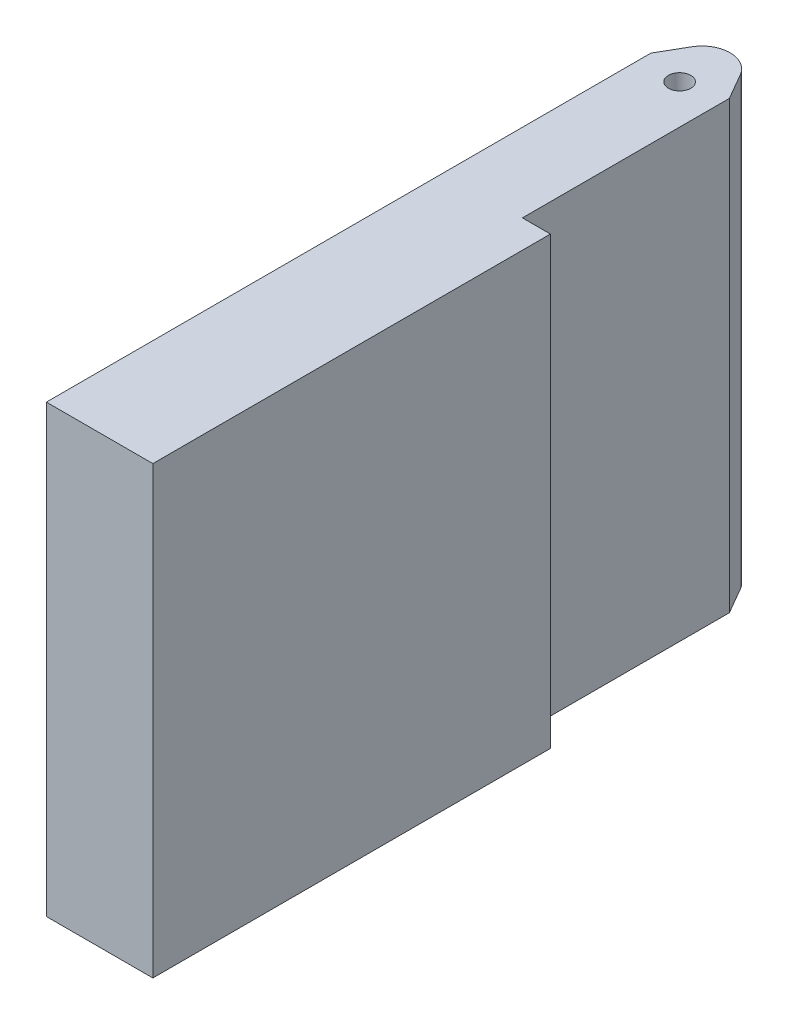
from build123d import *

# Parameters (mm, degrees)
SKETCH1_W           = 22
SKETCH1_H           = 120
BOSS_EXTRUDE1_DEPTH = 79.5
SKETCH2_OUTSIDE_W   = 53.124
SKETCH2_OUTSIDE_H   = 151.124
CUT_EXTRUDE1_DEPTH  = 101.206037742
FILLET1_R           = 5
CUT_EXTRUDE2_DEPTH  = 101.206037742
SKETCH4_W           = 96.947441117
SKETCH4_H           = 79.5
BOSS_EXTRUDE2_DEPTH = 5
SKETCH5_W           = 4
SKETCH5_H           = 96.947441117
CUT_EXTRUDE3_DEPTH  = 101.877400839
SKETCH6_W           = 4
SKETCH6_H           = 96.947441117
CUT_EXTRUDE4_DEPTH  = 101.877400839
SKETCH7_R           = 2
CUT_EXTRUDE5_DEPTH  = 101.320735643
SKETCH8_W           = 5
SKETCH8_H           = 26
CUT_EXTRUDE6_DEPTH  = 101.320735643


with BuildPart() as part:
    # Sketch1 → Boss-Extrude1 (new body)
    with BuildSketch(Plane(origin=(0, 0, 0), x_dir=(1, 0, 0), z_dir=(0, 1, 0))):
        Rectangle(SKETCH1_W, SKETCH1_H)
    extrude(amount=BOSS_EXTRUDE1_DEPTH)

    # Sketch2 outside → Cut-Extrude1 (cut, through all)
    with BuildSketch(Plane(origin=(0, 79.5, 0), x_dir=(1, 0, 0), z_dir=(0, 1, 0))):
        Rectangle(SKETCH2_OUTSIDE_W, SKETCH2_OUTSIDE_H)
        Polygon((0, 60), (-11, 40.947441117), (-11, -60), (11, -60), (11, 40.947441117), align=None, mode=Mode.SUBTRACT)
    extrude(amount=-CUT_EXTRUDE1_DEPTH, mode=Mode.SUBTRACT)

    # Fillet1
    fillet1_edges = [part.edges().sort_by_distance(p)[0] for p in [
        (0, 39.75, -60),
    ]]
    fillet(fillet1_edges, radius=FILLET1_R)

    # Sketch3 → Cut-Extrude2 (cut, through all)
    with BuildSketch(Plane(origin=(0, 79.5, 0), x_dir=(1, 0, 0), z_dir=(0, 1, 0))):
        Polygon((-11, 36.947441117), (-7, 36.947441117), (-7, 47.875644347), (-11, 40.947441117), align=None)
        Polygon((7, 47.875644347), (11, 40.947441117), (11, 36.947441117), (7, 36.947441117), align=None)
    extrude(amount=-CUT_EXTRUDE2_DEPTH, mode=Mode.SUBTRACT)

    # Sketch4 → Boss-Extrude2 (add)
    with BuildSketch(Plane(origin=(11, 0, 0), x_dir=(0, 0, -1), z_dir=(1, 0, 0))):
        with Locations((-11.526279442, 39.75)):
            Rectangle(SKETCH4_W, SKETCH4_H)
    extrude(amount=BOSS_EXTRUDE2_DEPTH)

    # Sketch5 → Cut-Extrude3 (cut, through all)
    with BuildSketch(Plane(origin=(0, 79.5, 0), x_dir=(1, 0, 0), z_dir=(0, 1, 0))):
        with Locations((-9, -11.526279442)):
            Rectangle(SKETCH5_W, SKETCH5_H)
    extrude(amount=-CUT_EXTRUDE3_DEPTH, mode=Mode.SUBTRACT)

    # Sketch6 → Cut-Extrude4 (cut, through all)
    with BuildSketch(Plane(origin=(0, 79.5, 0), x_dir=(1, 0, 0), z_dir=(0, 1, 0))):
        with Locations((14, -11.526279442)):
            Rectangle(SKETCH6_W, SKETCH6_H)
    extrude(amount=-CUT_EXTRUDE4_DEPTH, mode=Mode.SUBTRACT)

    # Sketch7 → Cut-Extrude5 (cut, through all)
    with BuildSketch(Plane(origin=(0, 79.5, 0), x_dir=(1, 0, 0), z_dir=(0, 1, 0))):
        with Locations(Location((0, 46, 0), (0, 0, 270))):
            Circle(SKETCH7_R)
    extrude(amount=-CUT_EXTRUDE5_DEPTH, mode=Mode.SUBTRACT)

    # Sketch8 → Cut-Extrude6 (cut, through all)
    with BuildSketch(Plane(origin=(0, 79.5, 0), x_dir=(1, 0, 0), z_dir=(0, 1, 0))):
        with Locations((9.5, 23.947441117)):
            Rectangle(SKETCH8_W, SKETCH8_H)
    extrude(amount=-CUT_EXTRUDE6_DEPTH, mode=Mode.SUBTRACT)


solid = part.part
